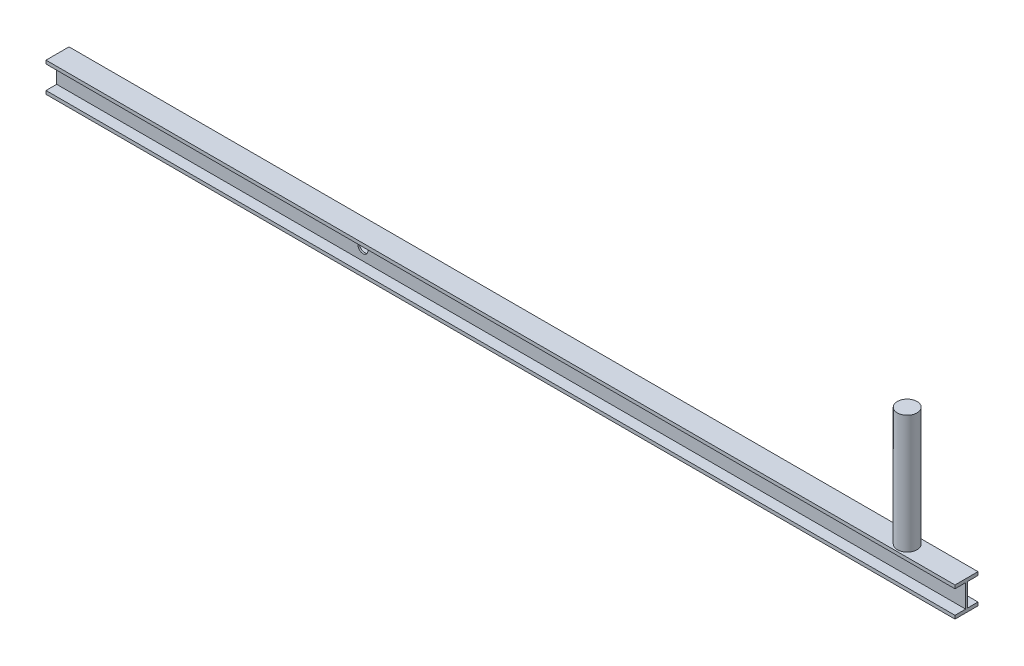
from build123d import *

# Parameters (mm, degrees)
BOSS_EXTRUDE1_DEPTH = 2336.8
SKETCH3_R           = 25.4
BOSS_EXTRUDE2_DEPTH = 304.8
SKETCH4_R           = 12.7
CUT_EXTRUDE2_DEPTH  = 16.51


with BuildPart() as part:
    # Sketch1 → Boss-Extrude1 (new body)
    with BuildSketch(Plane(origin=(0, 0, 0), x_dir=(0, 0, -1), z_dir=(1, 0, 0))):
        Polygon((59.182, 67.564), (59.182, 76.2), (0, 76.2), (0, 67.564), (27.432, 67.564), (27.432, 8.636), (0, 8.636), (0, 0), (59.182, 0), (59.182, 8.636), (31.75, 8.636), (31.75, 67.564), align=None)
    extrude(amount=BOSS_EXTRUDE1_DEPTH)

    # Sketch3 → Boss-Extrude2 (add)
    with BuildSketch(Plane(origin=(0, 76.2, 0), x_dir=(1, 0, 0), z_dir=(0, 1, 0))):
        with Locations(Location((2184.4, 29.591, 0), (0, 0, 90))):
            Circle(SKETCH3_R)
    extrude(amount=BOSS_EXTRUDE2_DEPTH)

    # Sketch4 → Cut-Extrude2 (cut)
    with BuildSketch(Plane.XY.offset(-31.75)):
        with Locations(Location((787.4, 38.1, 0), (0, 0, 180))):
            Circle(SKETCH4_R)
    extrude(amount=CUT_EXTRUDE2_DEPTH, mode=Mode.SUBTRACT)


solid = part.part
